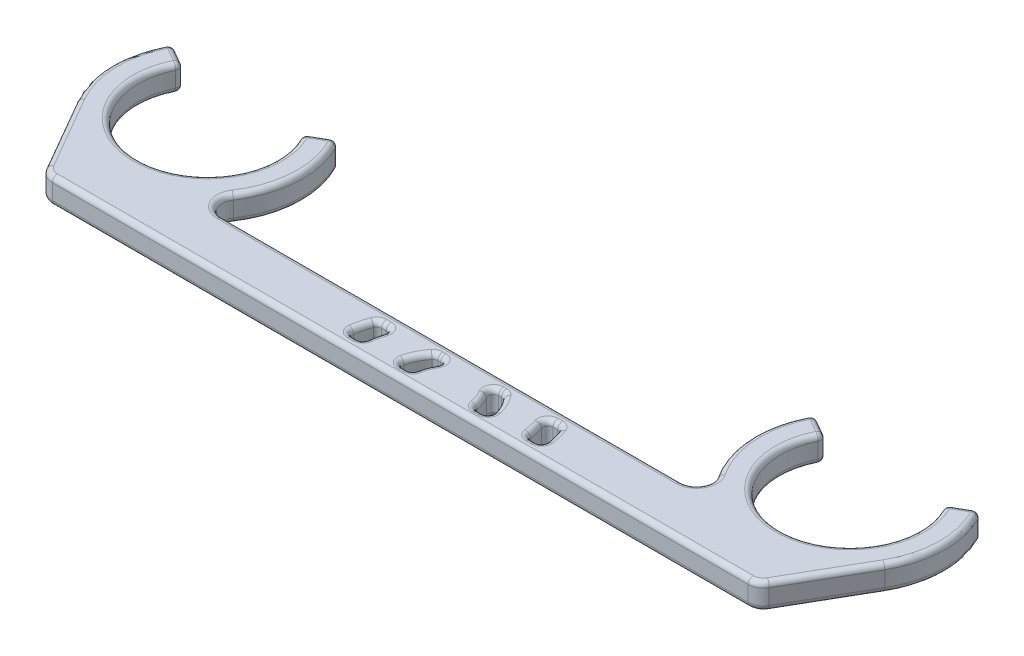
from build123d import *

# Parameters (mm, degrees)
EXTRUDE_1_DEPTH = 5
FILLET_1_R      = 3
FILLET_2_R      = 1
FILLET_3_R      = 1


with BuildPart() as part:
    # 草图1 → 凸台-拉伸1 (new body)
    with BuildSketch(Plane(origin=(0, 0, 0), x_dir=(1, 0, 0), z_dir=(0, 1, 0))):
        with BuildLine():
            Line((-11.691342951, 6.75), (-16.02146997, 9.25))
            ThreePointArc((-16.02146997, 9.25), (-18.5, 0), (-16.02146997, -9.25))
            Line((-16.02146997, -9.25), (-6.92820323, -25))
            Line((-6.92820323, -25), (131.92820323, -25))
            Line((131.92820323, -25), (141.02146997, -9.25))
            ThreePointArc((141.02146997, -9.25), (143.5, 0), (141.02146997, 9.25))
            Line((141.02146997, 9.25), (136.691342951, 6.75))
            ThreePointArc((136.691342951, 6.75), (125, -13.5), (113.308657049, 6.75))
            Line((113.308657049, 6.75), (108.97853003, 9.25))
            ThreePointArc((108.97853003, 9.25), (106.910172142, -3.874032535), (114.171796086, -15))
            Line((114.171796086, -15), (10.828203914, -15))
            ThreePointArc((10.828203914, -15), (18.089827858, -3.874032535), (16.02146997, 9.25))
            Line((16.02146997, 9.25), (11.691342951, 6.75))
            ThreePointArc((11.691342951, 6.75), (0, -13.5), (-11.691342951, 6.75))
        make_face()
        with BuildLine():
            Line((62.537267241, -22.738010391), (59.537267241, -22.738010391))
            ThreePointArc((59.537267241, -22.738010391), (60.262449345, -19.930897848), (61.842482751, -17.5))
            Line((61.842482751, -17.5), (64.842482751, -17.5))
            ThreePointArc((64.842482751, -17.5), (63.262449345, -19.930897848), (62.537267241, -22.738010391))
        make_face(mode=Mode.SUBTRACT)
        with BuildLine():
            Line((53.690457943, -17.5), (50.690457943, -17.5))
            ThreePointArc((50.690457943, -17.5), (49.920749917, -19.911063014), (49.540868521, -22.413335066))
            Line((49.540868521, -22.413335066), (52.540868521, -22.413335066))
            ThreePointArc((52.540868521, -22.413335066), (52.920749917, -19.911063014), (53.690457943, -17.5))
        make_face(mode=Mode.SUBTRACT)
        with BuildLine():
            Line((75.157517249, -17.5), (72.157517249, -17.5))
            ThreePointArc((72.157517249, -17.5), (73.737550655, -19.930897848), (74.462732759, -22.738010391))
            Line((74.462732759, -22.738010391), (77.462732759, -22.738010391))
            ThreePointArc((77.462732759, -22.738010391), (76.737550655, -19.930897848), (75.157517249, -17.5))
        make_face(mode=Mode.SUBTRACT)
        with BuildLine():
            Line((83.309542057, -17.5), (86.309542057, -17.5))
            ThreePointArc((86.309542057, -17.5), (87.079250083, -19.911063014), (87.459131479, -22.413335066))
            Line((87.459131479, -22.413335066), (84.459131479, -22.413335066))
            ThreePointArc((84.459131479, -22.413335066), (84.079250083, -19.911063014), (83.309542057, -17.5))
        make_face(mode=Mode.SUBTRACT)
    extrude(amount=EXTRUDE_1_DEPTH)

    # 圆角1
    fillet_1_edges = [part.edges().sort_by_distance(p)[0] for p in [
        (10.828203914, 2.5, 15),
        (114.171796086, 2.5, 15),
        (131.92820323, 2.5, 25),
        (-6.92820323, 2.5, 25),
    ]]
    fillet(fillet_1_edges, radius=FILLET_1_R)

    # 圆角2
    fillet_2_edges = [part.edges().sort_by_distance(p)[0] for p in [
        (11.691342951, 2.5, -6.75),
        (16.02146997, 2.5, -9.25),
        (108.97853003, 2.5, -9.25),
        (113.308657049, 2.5, -6.75),
        (136.691342951, 2.5, -6.75),
        (141.02146997, 2.5, -9.25),
        (-16.02146997, 2.5, -9.25),
        (-11.691342951, 2.5, -6.75),
        (61.842482751, 2.5, 17.5),
        (59.537267241, 2.5, 22.738010391),
        (62.537267241, 2.5, 22.738010391),
        (64.842482751, 2.5, 17.5),
        (52.540868521, 2.5, 22.413335066),
        (53.690457943, 2.5, 17.5),
        (50.690457943, 2.5, 17.5),
        (49.540868521, 2.5, 22.413335066),
        (77.462732759, 2.5, 22.738010391),
        (75.157517249, 2.5, 17.5),
        (72.157517249, 2.5, 17.5),
        (74.462732759, 2.5, 22.738010391),
        (87.459131479, 2.5, 22.413335066),
        (86.309542057, 2.5, 17.5),
        (83.309542057, 2.5, 17.5),
        (84.459131479, 2.5, 22.413335066),
    ]]
    fillet(fillet_2_edges, radius=FILLET_2_R)

    # 圆角3
    fillet_3_edges = [part.edges().sort_by_distance(p)[0] for p in [
        (62.5, 5, 15),
        (18.463463444, 5, 1.162117739),
        (-6.696152423, 5, 24.598076211),
        (131.696152423, 5, 24.598076211),
        (109.808385092, 0, 13.410096484),
        (109.808385092, 5, 13.410096484),
        (15.191614908, 0, 13.410096484),
        (15.191614908, 5, 13.410096484),
        (85.176410639, 0, 17.5),
        (85.176410639, 5, 17.5),
        (84.134383747, 0, 20.155303376),
        (84.134383747, 5, 20.155303376),
        (85.855277497, 0, 22.413335066),
        (85.855277497, 5, 22.413335066),
        (87.02769113, 0, 19.697331214),
        (87.02769113, 5, 19.697331214),
        (-11.907849302, 5, 16.375),
        (74.4135789, 0, 17.5),
        (74.4135789, 5, 17.5),
        (73.934219025, 0, 20.415499699),
        (73.934219025, 5, 20.415499699),
        (75.811985428, 0, 22.738010391),
        (75.811985428, 5, 22.738010391),
        (76.577537476, 0, 19.587138377),
        (76.577537476, 5, 19.587138377),
        (61.188014572, 0, 22.738010391),
        (61.188014572, 5, 22.738010391),
        (63.065780975, 0, 20.415499699),
        (63.065780975, 5, 20.415499699),
        (62.5864211, 0, 17.5),
        (62.5864211, 5, 17.5),
        (60.422462524, 0, 19.587138377),
        (60.422462524, 5, 19.587138377),
        (-18.492441261, 0, 0.528787481),
        (-18.492441261, 5, 0.528787481),
        (-13.829075284, 0, -7.984220338),
        (0, 0, 13.5),
        (13.829075284, 0, -7.984220338),
        (106.536536556, 0, 1.162117739),
        (111.170924716, 0, -7.984220338),
        (125, 0, 13.5),
        (143.492441261, 0, 0.528787481),
        (138.829075284, 0, -7.984220338),
        (52.865616253, 0, 20.155303376),
        (51.823589361, 0, 17.5),
        (49.97230887, 0, 19.697331214),
        (51.144722503, 0, 22.413335066),
        (140.917003209, 0, -8.827810516),
        (137.07104923, 0, -6.658705238),
        (112.92895077, 0, -6.658705238),
        (109.082996791, 0, -8.827810516),
        (15.917003209, 0, -8.827810516),
        (12.07104923, 0, -6.658705238),
        (-12.07104923, 0, -6.658705238),
        (-15.917003209, 0, -8.827810516),
        (-13.829075284, 5, -7.984220338),
        (138.829075284, 5, -7.984220338),
        (125, 5, 13.5),
        (111.170924716, 5, -7.984220338),
        (106.536536556, 5, 1.162117739),
        (-11.907849302, 0, 16.375),
        (13.829075284, 5, -7.984220338),
        (0, 5, 13.5),
        (51.823589361, 5, 17.5),
        (52.865616253, 5, 20.155303376),
        (51.144722503, 5, 22.413335066),
        (49.97230887, 5, 19.697331214),
        (140.917003209, 5, -8.827810516),
        (137.07104923, 5, -6.658705238),
        (112.92895077, 5, -6.658705238),
        (109.082996791, 5, -8.827810516),
        (15.917003209, 5, -8.827810516),
        (12.07104923, 5, -6.658705238),
        (-12.07104923, 5, -6.658705238),
        (-15.917003209, 5, -8.827810516),
        (83.925252063, 0, 17.907304071),
        (83.925252063, 5, 17.907304071),
        (84.703364528, 0, 22.163685125),
        (84.703364528, 5, 22.163685125),
        (87.102078725, 0, 22.067988737),
        (87.102078725, 5, 22.067988737),
        (86.197868764, 0, 17.682357205),
        (86.197868764, 5, 17.682357205),
        (73.259921447, 0, 18.002817549),
        (73.259921447, 5, 18.002817549),
        (74.693719511, 0, 22.506716506),
        (74.693719511, 5, 22.506716506),
        (77.073998647, 0, 22.359591951),
        (77.073998647, 5, 22.359591951),
        (75.128528545, 0, 17.596666167),
        (75.128528545, 5, 17.596666167),
        (62.306280489, 0, 22.506716506),
        (62.306280489, 5, 22.506716506),
        (63.740078553, 0, 18.002817549),
        (63.740078553, 5, 18.002817549),
        (59.926001353, 0, 22.359591951),
        (59.926001353, 5, 22.359591951),
        (61.871471454, 0, 17.596666167),
        (61.871471454, 5, 17.596666167),
        (49.897921275, 0, 22.067988737),
        (49.897921275, 5, 22.067988737),
        (52.296635472, 0, 22.163685125),
        (52.296635472, 5, 22.163685125),
        (50.802131236, 0, 17.682357205),
        (50.802131236, 5, 17.682357205),
        (53.074747937, 0, 17.907304071),
        (53.074747937, 5, 17.907304071),
        (143.492441261, 5, 0.528787481),
        (136.907849302, 0, 16.375),
        (136.907849302, 5, 16.375),
        (18.463463444, 0, 1.162117739),
        (62.5, 0, 15),
        (62.5, 0, 25),
        (-6.696152423, 0, 24.598076211),
        (131.696152423, 0, 24.598076211),
        (62.5, 5, 25),
    ]]
    fillet(fillet_3_edges, radius=FILLET_3_R)


solid = part.part
